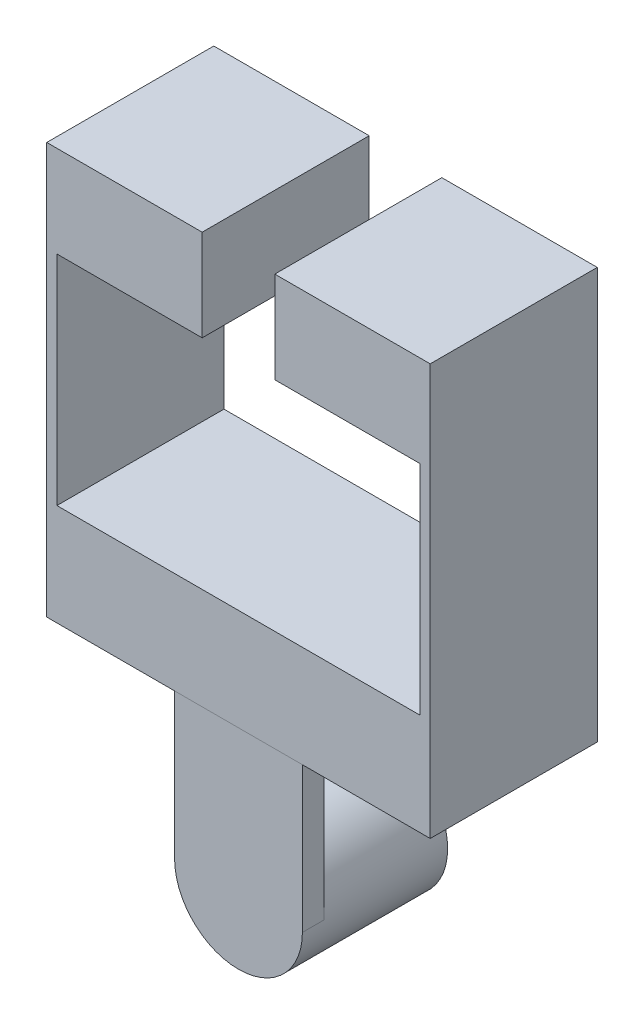
from build123d import *

# Parameters (mm, degrees)
BOSS_EXTRUDE2_DEPTH = 29.21
SKETCH2_W           = 22.352
SKETCH2_H           = 25.4
BOSS_EXTRUDE3_DEPTH = 3.81
SKETCH5_R           = 11.176
BOSS_EXTRUDE6_DEPTH = 25.4


with BuildPart() as part:
    # Sketch1 → Boss-Extrude2 (new body)
    with BuildSketch(Plane.XY):
        Polygon((-12.043317073, 53.947940362), (15.134682927, 53.947940362), (15.134682927, -17.934059638), (-51.921317073, -17.934059638), (-51.921317073, 53.947940362), (-24.743317073, 53.947940362), (-24.743317073, 37.945940362), (-50.143317073, 37.945940362), (-50.143317073, -0.154059638), (13.356682927, -0.154059638), (13.356682927, 37.945940362), (-12.043317073, 37.945940362), align=None)
    extrude(amount=BOSS_EXTRUDE2_DEPTH)

    # Sketch2 → Boss-Extrude3 (add)
    with BuildSketch(Plane.XY.offset(29.21)):
        with Locations((-18.393317073, -30.634059638)):
            Rectangle(SKETCH2_W, SKETCH2_H)
    extrude(amount=-BOSS_EXTRUDE3_DEPTH)

    # Sketch5 → Boss-Extrude6 (add)
    with BuildSketch(Plane.XY.offset(29.21)):
        with Locations((-18.393317073, -43.334059638)):
            Circle(SKETCH5_R)
    extrude(amount=-BOSS_EXTRUDE6_DEPTH)


solid = part.part
